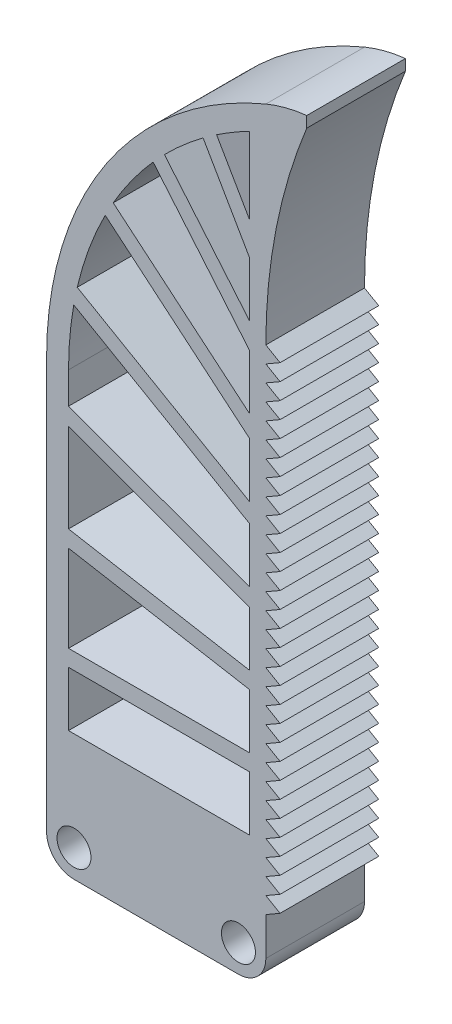
from build123d import *

# Parameters (mm, degrees)
BOSS_EXTRUDE1_DEPTH     = 18
SKETCH3_W               = 33
SKETCH3_H               = 10
CUT_EXTRUDE1_DEPTH      = 143.562267098
CUT_EXTRUDE2_DEPTH      = 143.562267098
CUT_EXTRUDE3_DEPTH      = 143.562267098
CUT_EXTRUDE4_DEPTH      = 143.562267098
BOSS_EXTRUDE2_DEPTH     = 18
BOSS_EXTRUDE3_DEPTH     = 18
LPATTERN1_COUNT         = 30
LPATTERN1_PITCH         = 3
CUT_EXTRUDE5_DEPTH      = 146.668613805
CUT_EXTRUDE6_DEPTH      = 146.668613805
CUT_EXTRUDE7_DEPTH      = 146.668613805
CUT_EXTRUDE8_DEPTH      = 146.668613805
FILLET1_R               = 5
F_6_0_MM_DOWEL_HOLES1_D = 6.2


with BuildPart() as part:
    # Sketch2 → Boss-Extrude1 (new body)
    with BuildSketch(Plane.XY):
        with BuildLine():
            Line((-20, 0), (20, 0))
            Line((20, 0), (20, 140))
            ThreePointArc((20, 140), (-9.083269132, 116.055512755), (-20, 80))
            Line((-20, 80), (-20, 0))
        make_face()
    extrude(amount=BOSS_EXTRUDE1_DEPTH)

    # Sketch3 → Cut-Extrude1 (cut, through all)
    with BuildSketch(Plane.XY.offset(18)):
        with Locations((0.5, 28)):
            Rectangle(SKETCH3_W, SKETCH3_H)
    extrude(amount=-CUT_EXTRUDE1_DEPTH, mode=Mode.SUBTRACT)

    # Sketch4 → Cut-Extrude2 (cut, through all)
    with BuildSketch(Plane.XY.offset(18)):
        Polygon((-16, 36), (17, 36), (17, 46), (-16, 51.818790363), align=None)
    extrude(amount=-CUT_EXTRUDE2_DEPTH, mode=Mode.SUBTRACT)

    # Sketch5 → Cut-Extrude3 (cut, through all)
    with BuildSketch(Plane.XY.offset(18)):
        Polygon((-16, 54.865070199), (17, 49.046279836), (17, 59.046279836), (-16, 71.057297566), align=None)
    extrude(amount=-CUT_EXTRUDE3_DEPTH, mode=Mode.SUBTRACT)

    # Sketch6 → Cut-Extrude4 (cut, through all)
    with BuildSketch(Plane.XY.offset(18)):
        with BuildLine():
            Line((-16, 74.249830884), (17, 62.238813153))
            Line((17, 62.238813153), (17, 72.238813153))
            Line((17, 72.238813153), (-15.046889298, 90.741093316))
            ThreePointArc((-15.046889298, 90.741093316), (-15.761255119, 85.391648765), (-16, 80))
            Line((-16, 80), (-16, 74.249830884))
        make_face()
    extrude(amount=-CUT_EXTRUDE4_DEPTH, mode=Mode.SUBTRACT)

    # Sketch13 → Boss-Extrude2 (add)
    with BuildSketch(Plane.XY.offset(18)):
        with BuildLine():
            Line((27.463865989, 141.919276749), (27.463865989, 139.919276749))
            ThreePointArc((27.463865989, 139.919276749), (21.883638711, 121.290161062), (20, 101.934676234))
            Line((20, 101.934676234), (20, 140))
            ThreePointArc((20, 140), (23.663152719, 141.227117654), (27.463865989, 141.919276749))
        make_face()
    extrude(amount=-BOSS_EXTRUDE2_DEPTH)

    # Sketch15 → Boss-Extrude3 (add)
    with BuildSketch(Plane.XY.offset(18)):
        Polygon((20, 101.934676234), (22.598076211, 100.434676234), (20, 98.934676234), align=None)
    boss_extrude3 = extrude(amount=-BOSS_EXTRUDE3_DEPTH)

    # LPattern1: Boss-Extrude3 ×30
    with Locations(*[(0, -i * LPATTERN1_PITCH, 0) for i in range(1, LPATTERN1_COUNT)]):
        add(boss_extrude3)

    # Sketch17 → Cut-Extrude5 (cut, through all)
    with BuildSketch(Plane.XY.offset(18)):
        with BuildLine():
            Line((-14.409820926, 93.837383335), (17, 75.702914768))
            Line((17, 75.702914768), (17, 85.702914768))
            Line((17, 85.702914768), (-9.308172311, 107.778092451))
            ThreePointArc((-9.308172311, 107.778092451), (-12.284651864, 100.963507838), (-14.409820926, 93.837383335))
        make_face()
    extrude(amount=-CUT_EXTRUDE5_DEPTH, mode=Mode.SUBTRACT)

    # Sketch18 → Cut-Extrude6 (cut, through all)
    with BuildSketch(Plane.XY.offset(18)):
        with BuildLine():
            Line((-7.846238812, 110.46760646), (17, 89.619136636))
            Line((17, 89.619136636), (17, 99.619136636))
            Line((17, 99.619136636), (-0.566824758, 120.554463152))
            ThreePointArc((-0.566824758, 120.554463152), (-4.464319866, 115.697073553), (-7.846238812, 110.46760646))
        make_face()
    extrude(amount=-CUT_EXTRUDE6_DEPTH, mode=Mode.SUBTRACT)

    # Sketch19 → Cut-Extrude7 (cut, through all)
    with BuildSketch(Plane.XY.offset(18)):
        with BuildLine():
            Line((1.497556464, 122.761400894), (17, 104.286308117))
            Line((17, 104.286308117), (17, 114.286308117))
            Line((17, 114.286308117), (8.554035532, 128.915147695))
            ThreePointArc((8.554035532, 128.915147695), (4.907555132, 125.973860666), (1.497556464, 122.761400894))
        make_face()
    extrude(amount=-CUT_EXTRUDE7_DEPTH, mode=Mode.SUBTRACT)

    # Sketch21 → Cut-Extrude8 (cut, through all)
    with BuildSketch(Plane.XY.offset(18)):
        with BuildLine():
            Line((11.013641865, 130.654984559), (17, 120.286308117))
            Line((17, 120.286308117), (17, 134.194095619))
            ThreePointArc((17, 134.194095619), (13.956345649, 132.509918344), (11.013641865, 130.654984559))
        make_face()
    extrude(amount=-CUT_EXTRUDE8_DEPTH, mode=Mode.SUBTRACT)

    # Fillet1
    fillet1_edges = [part.edges().sort_by_distance(p)[0] for p in [
        (20, 0, 9),
        (-20, 0, 9),
    ]]
    fillet(fillet1_edges, radius=FILLET1_R)

    # Ø6.0 mm Dowel Holes1 (through all)
    with Locations(Plane.XY.offset(18)):
        with Locations((-15, 5)):
            f_6_0_mm_dowel_holes1 = Hole(F_6_0_MM_DOWEL_HOLES1_D / 2)

    # Mirror1: Ø6.0 mm Dowel Holes1 across plane
    add(f_6_0_mm_dowel_holes1.mirror(Plane(origin=(0, 0, 0), x_dir=(0, 0, 1), z_dir=(1, 0, 0))), mode=Mode.SUBTRACT)


solid = part.part
